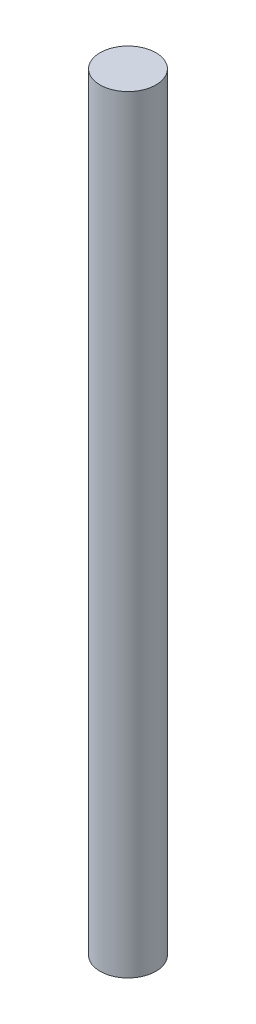
from build123d import *

# Parameters (mm, degrees)
SKETCH_1_R      = 4
EXTRUDE_1_DEPTH = 110


with BuildPart() as part:
    # 草图1 → 凸台-拉伸1 (new body)
    with BuildSketch(Plane(origin=(0, 0, 0), x_dir=(1, 0, 0), z_dir=(0, 1, 0))):
        with Locations(Location((0, 0, 0), (0, 0, 270))):
            Circle(SKETCH_1_R)
    extrude(amount=EXTRUDE_1_DEPTH)


solid = part.part
